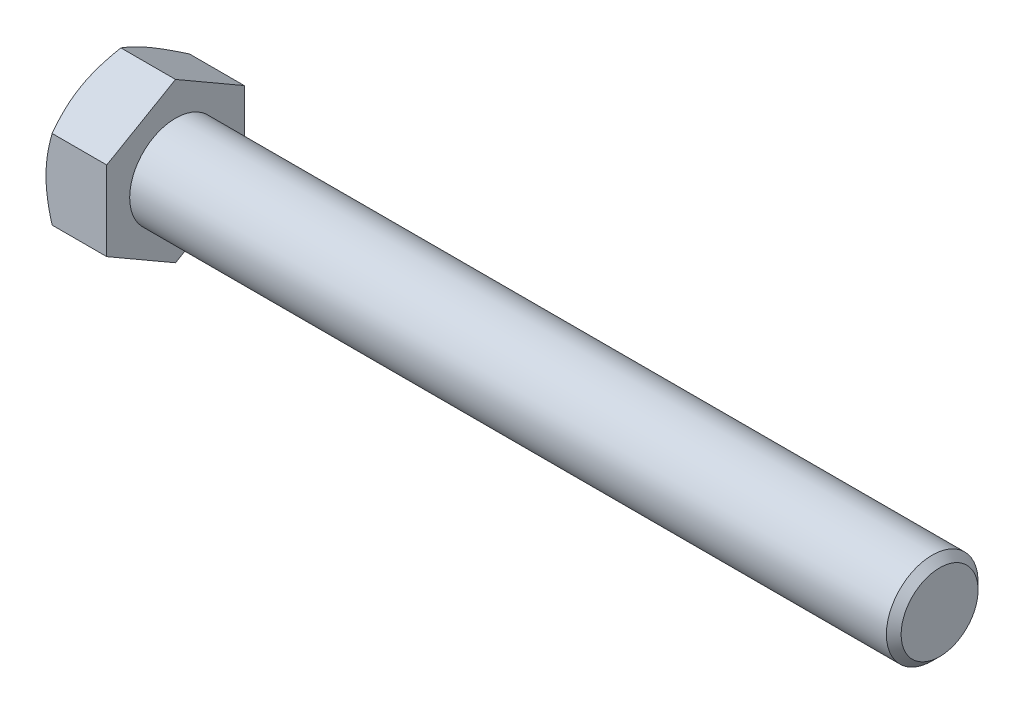
from build123d import *

# Parameters (mm, degrees)
BASEHEAD_DEPTH = 7.95


with BuildPart() as part:
    # Sketch1 → BaseHead (new body)
    with BuildSketch(Plane(origin=(0, 0, 0), x_dir=(0, 0, -1), z_dir=(1, 0, 0))):
        Polygon((9, 5.196152423), (9, -5.196152423), (0, -10.392304845), (-9, -5.196152423), (-9, 5.196152423), (0, 10.392304845), align=None)
    extrude(amount=BASEHEAD_DEPTH)

    # BodySke → BaseBody (revolve)
    with BuildSketch(Plane.XY, mode=Mode.PRIVATE) as basebody_sk:
        Polygon((0, 0), (107.95, 0), (107.95, 5.036), (106.986, 6), (0, 6), align=None)
    revolve(basebody_sk.sketch.rotate(Axis((0, 0, 0), (1, 0, 0)), 90), axis=Axis((0, 0, 0), (1, 0, 0)))

    # Sketch3 → HeadChamfer (revolve, cut)
    with BuildSketch(Plane.XY):
        Polygon((0, 9), (3.690598923, 15.392304845), (3.690598923, 20.392304845), (-10, 20.392304845), (-10, 9), align=None)
    revolve(axis=Axis((0, 0, 0), (1, 0, 0)), mode=Mode.SUBTRACT)


solid = part.part
